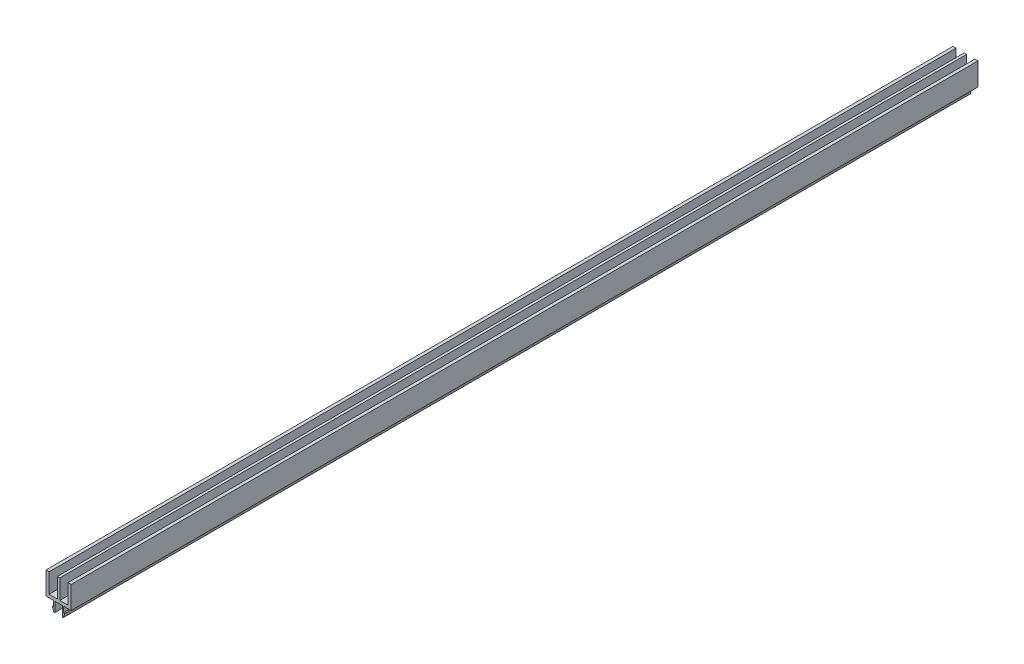
from build123d import *

# Parameters (mm, degrees)
BOSS_EXTRU_1_DEPTH = 722


with BuildPart() as part:
    # Esquisse1 → Boss.-Extru.1 (new body)
    with BuildSketch(Plane.XY.offset(50)):
        Polygon((-1, 2.5), (-7.5, 2.5), (-7.5, 17.999999998), (-10, 17.999999998), (-10, 0), (-4, 0), (-4, -4.5), (-5, -4.5), (-3.75, -8), (-3, -8), (-3, 0), (3, 0), (3, -8), (3.75, -8), (5, -4.5), (4, -4.5), (4, 0), (10, 0), (10, 17.999999998), (7.5, 17.999999998), (7.5, 2.5), (1, 2.5), (1, 17.999999998), (-1, 17.999999998), align=None)
    extrude(amount=-BOSS_EXTRU_1_DEPTH)


solid = part.part
